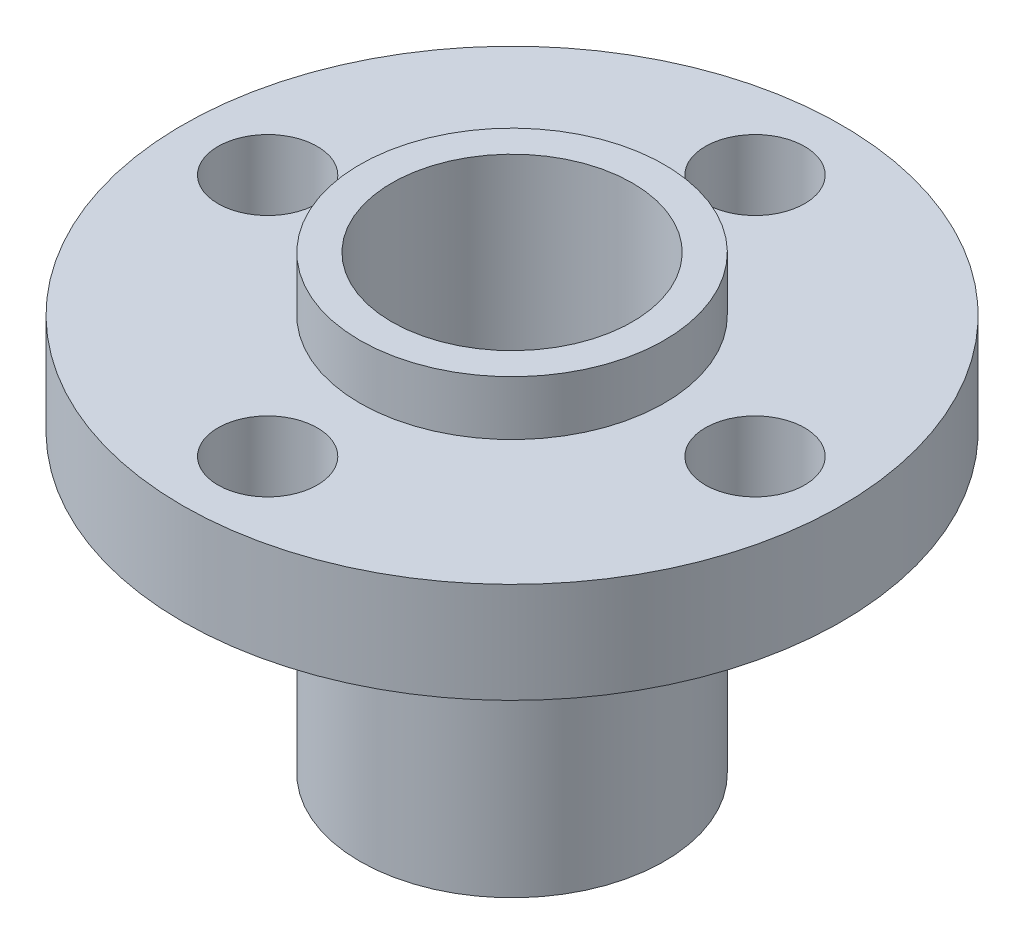
from build123d import *

# Parameters (mm, degrees)
SKETCH_1_R      = 5.06
SKETCH_1_R_2    = 4
EXTRUDE_1_DEPTH = 15
EXTRUDE_START   = 9.85
SKETCH_1_3_R    = 10.955
SKETCH_1_3_R_2  = 1.65
SKETCH_1_3_R_3  = 5.06
EXTRUDE_2_DEPTH = 3.34


with BuildPart() as part:
    # Эскиз1 → Бобышка-Вытянуть1 (new body)
    with BuildSketch(Plane(origin=(0, 0, 0), x_dir=(1, 0, 0), z_dir=(0, 1, 0))):
        Circle(SKETCH_1_R)
        Circle(SKETCH_1_R_2, mode=Mode.SUBTRACT)
    extrude(amount=EXTRUDE_1_DEPTH)

    # Эскиз1<3> → Бобышка-Вытянуть2 (add)
    with BuildSketch(Plane(origin=(0, 0, 0), x_dir=(1, 0, 0), z_dir=(0, 1, 0)).offset(EXTRUDE_START)):
        Circle(SKETCH_1_3_R)
        with Locations((-8.1, -0.024689505)):
            Circle(SKETCH_1_3_R_2, mode=Mode.SUBTRACT)
        with Locations((0, -8.124689505)):
            Circle(SKETCH_1_3_R_2, mode=Mode.SUBTRACT)
        with Locations((8.1, -0.024689505)):
            Circle(SKETCH_1_3_R_2, mode=Mode.SUBTRACT)
        Circle(SKETCH_1_3_R_3, mode=Mode.SUBTRACT)
        with Locations((0, 8.075310495)):
            Circle(SKETCH_1_3_R_2, mode=Mode.SUBTRACT)
    extrude(amount=EXTRUDE_2_DEPTH)


solid = part.part
